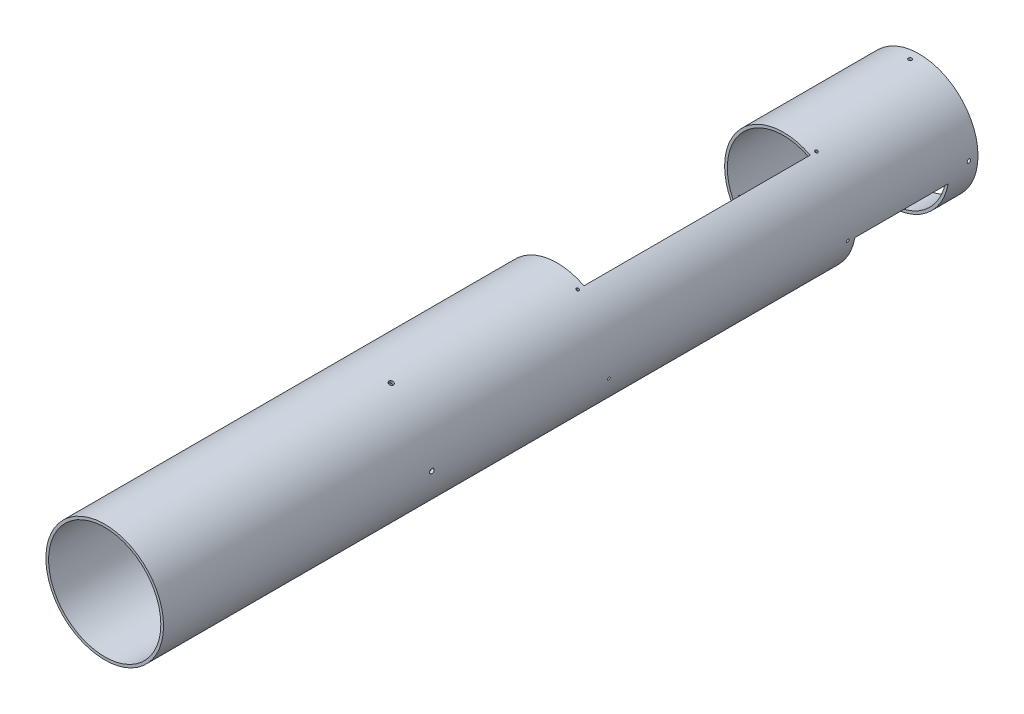
from build123d import *

# Parameters (mm, degrees)
SKETCH1_R           = 65
SKETCH1_R_2         = 62
BOSS_EXTRUDE1_DEPTH = 900
SKETCH4_W           = 130
SKETCH4_H           = 250
CUT_EXTRUDE4_DEPTH  = 516
SKETCH5_R           = 2
CUT_EXTRUDE5_DEPTH  = 85
CIRPATTERN1_COUNT   = 4
SKETCH7_R           = 1.5
CUT_EXTRUDE6_DEPTH  = 243
CIRPATTERN2_COUNT   = 5
SKETCH8_R           = 2.5
CUT_EXTRUDE7_DEPTH  = 209
CIRPATTERN3_COUNT   = 5
CUT_EXTRUDE8_START  = -103
CUT_EXTRUDE8_DEPTH  = 103


with BuildPart() as part:
    # Sketch1 → Boss-Extrude1 (new body)
    with BuildSketch(Plane.XY):
        Circle(SKETCH1_R)
        Circle(SKETCH1_R_2, mode=Mode.SUBTRACT)
    extrude(amount=BOSS_EXTRUDE1_DEPTH)

    # Sketch4 → Cut-Extrude4 (cut)
    with BuildSketch(Plane(origin=(-14.142135624, 14.142135624, 0), x_dir=(0.7071067811865477, 0.7071067811865475, 0), z_dir=(-0.7071067811865475, 0.7071067811865477, 0))):
        with Locations((0, -275)):
            Rectangle(SKETCH4_W, SKETCH4_H)
    extrude(amount=CUT_EXTRUDE4_DEPTH, mode=Mode.SUBTRACT)

    # Sketch5 → Cut-Extrude5 (cut)
    with BuildSketch(Plane(origin=(0, 0, 0), x_dir=(1, 0, 0), z_dir=(0, 1, 0))):
        with Locations(Location((0, -10, 0), (0, 0, 270))):
            Circle(SKETCH5_R)
    cut_extrude5 = extrude(amount=-CUT_EXTRUDE5_DEPTH, mode=Mode.SUBTRACT)

    # CirPattern1: Cut-Extrude5 ×4 about axis
    cirpattern1_axis = Axis((0, 0, 900), (0, 0, -1))
    for i in range(1, CIRPATTERN1_COUNT):
        add(cut_extrude5.rotate(cirpattern1_axis, i * 360 / CIRPATTERN1_COUNT), mode=Mode.SUBTRACT)

    # Sketch7 → Cut-Extrude6 (cut)
    with BuildSketch(Plane(origin=(-14.142135624, 14.142135624, 0), x_dir=(0.7071067811865477, 0.7071067811865475, 0), z_dir=(-0.7071067811865475, 0.7071067811865477, 0))):
        with Locations((0, -143)):
            Circle(SKETCH7_R)
        with Locations((0, -407)):
            Circle(SKETCH7_R)
    cut_extrude6 = extrude(amount=CUT_EXTRUDE6_DEPTH, mode=Mode.SUBTRACT)

    # CirPattern2: Cut-Extrude6 ×5 about axis
    cirpattern2_axis = Axis((0, 0, 900), (0, 0, -1))
    for i in range(1, CIRPATTERN2_COUNT):
        add(cut_extrude6.rotate(cirpattern2_axis, i * 360 / CIRPATTERN2_COUNT), mode=Mode.SUBTRACT)

    # Sketch8 → Cut-Extrude7 (cut)
    with BuildSketch(Plane(origin=(0, 0, 0), x_dir=(0, 0, -1), z_dir=(1, 0, 0))):
        with Locations(Location((-603.5, 0, 0), (0, 0, 180))):
            Circle(SKETCH8_R)
    cut_extrude7 = extrude(amount=CUT_EXTRUDE7_DEPTH, mode=Mode.SUBTRACT)

    # CirPattern3: Cut-Extrude7 ×5 about axis
    cirpattern3_axis = Axis((0, 0, 900), (0, 0, -1))
    for i in range(1, CIRPATTERN3_COUNT):
        add(cut_extrude7.rotate(cirpattern3_axis, i * 360 / CIRPATTERN3_COUNT), mode=Mode.SUBTRACT)

    # Sketch9 → Cut-Extrude8 (cut)
    with BuildSketch(Plane.XY.offset(135).offset(CUT_EXTRUDE8_START)):
        with BuildLine():
            Line((0, 0), (11.287131548, -64.012503946))
            ThreePointArc((11.287131548, -64.012503946), (45.961940777, -45.961940777), (64.012503946, -11.287131548))
            Line((64.012503946, -11.287131548), (0, 0))
        make_face()
    extrude(amount=CUT_EXTRUDE8_DEPTH, mode=Mode.SUBTRACT)


solid = part.part
